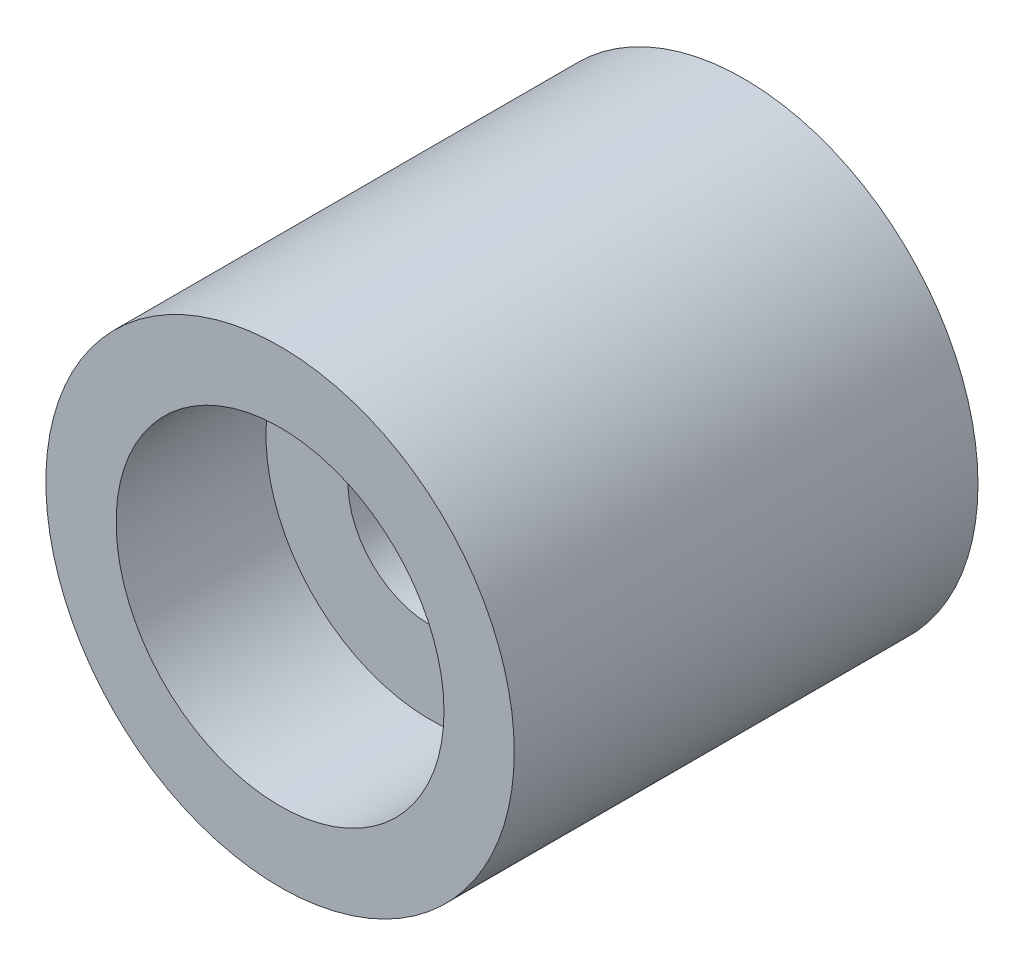
from build123d import *


with BuildPart() as part:
    # Sketch1 → Revolve1 (revolve)
    with BuildSketch(Plane(origin=(0, 0, 0), x_dir=(1, 0, 0), z_dir=(0, 1, 0)), mode=Mode.PRIVATE) as revolve1_sk:
        Polygon((-1.75, -1.75), (-1.75, 1.75), (-3.5, 1.75), (-3.5, 4.95), (-5, 4.95), (-5, -4.95), (-3.5, -4.95), (-3.5, -1.75), align=None)
    revolve(revolve1_sk.sketch.rotate(Axis((0, 0, 0), (0, 0, -1)), 180), axis=Axis((0, 0, 0), (0, 0, -1)))


solid = part.part
